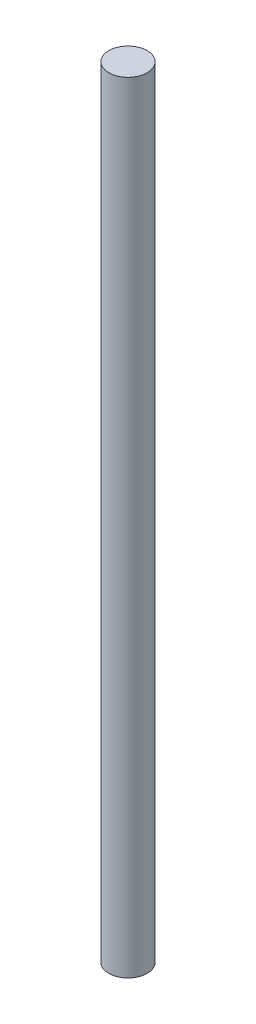
from build123d import *

# Parameters (mm, degrees)
SKETCH1_R           = 2.5
BOSS_EXTRUDE1_DEPTH = 101.6


with BuildPart() as part:
    # Sketch1 → Boss-Extrude1 (new body)
    with BuildSketch(Plane(origin=(0, 0, 0), x_dir=(1, 0, 0), z_dir=(0, 1, 0))):
        with Locations(Location((0, 0, 0), (0, 0, 270))):
            Circle(SKETCH1_R)
    extrude(amount=BOSS_EXTRUDE1_DEPTH)


solid = part.part
